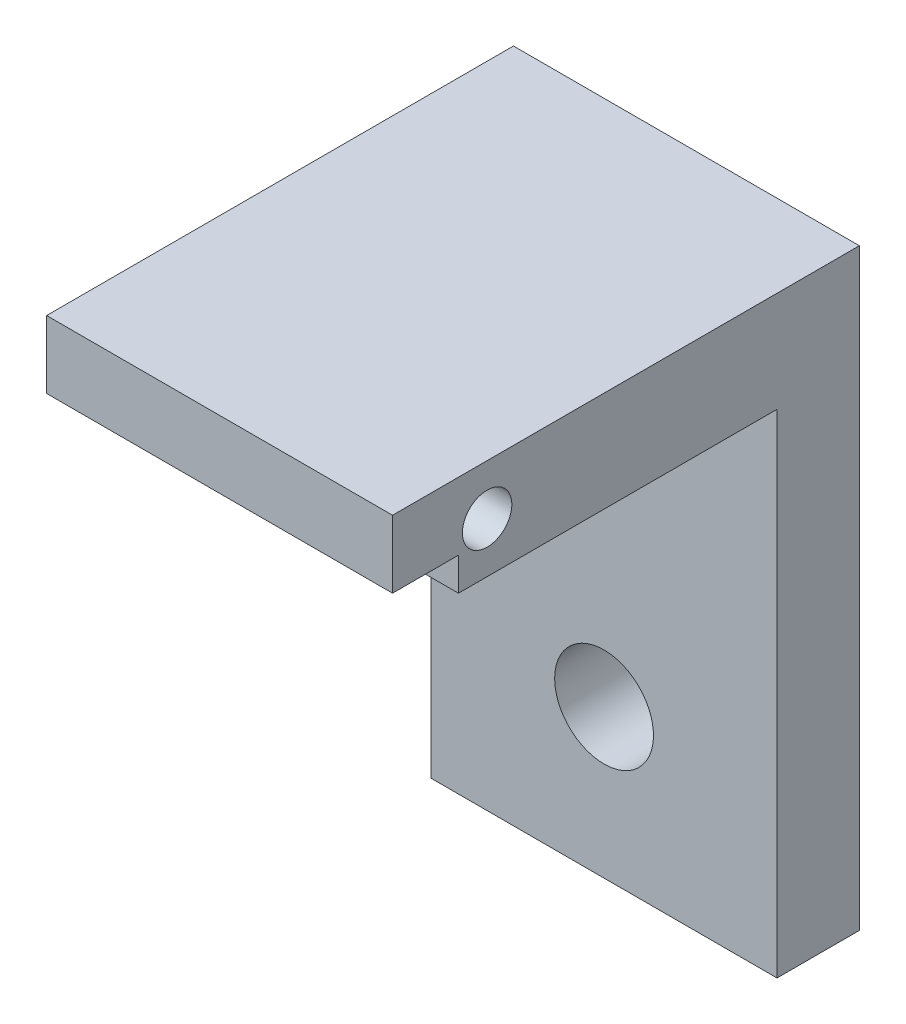
from build123d import *

# Parameters (mm, degrees)
SKETCH1_W           = 10.5
SKETCH1_H           = 5
BOSS_EXTRUDE1_DEPTH = 18
SKETCH2_W           = 10.5
SKETCH2_H           = 5
BOSS_EXTRUDE2_DEPTH = 7.3
SKETCH3_W           = 10.5
SKETCH3_H           = 1.95
CUT_EXTRUDE1_DEPTH  = 7.3
SKETCH4_W           = 10.5
SKETCH4_H           = 2.5
CUT_EXTRUDE2_DEPTH  = 26.3
SKETCH5_R           = 1.5
CUT_EXTRUDE3_DEPTH  = 26.3
SKETCH6_W           = 1.13
SKETCH6_H           = 3.05
CUT_EXTRUDE4_DEPTH  = 26.3
SKETCH10_W          = 10.5
SKETCH10_H          = 3.05
BOSS_EXTRUDE3_DEPTH = 5.5
SKETCH11_R          = 0.75
CUT_EXTRUDE6_DEPTH  = 12.5
SKETCH12_W          = 2
SKETCH12_H          = 1
CUT_EXTRUDE7_DEPTH  = 12.5


with BuildPart() as part:
    # Sketch1 → Boss-Extrude1 (new body)
    with BuildSketch(Plane(origin=(0, 0, 0), x_dir=(1, 0, 0), z_dir=(0, 1, 0))):
        Rectangle(SKETCH1_W, SKETCH1_H)
    extrude(amount=BOSS_EXTRUDE1_DEPTH)

    # Sketch2 → Boss-Extrude2 (add)
    with BuildSketch(Plane.XY.offset(2.5)):
        with Locations((0, 15.5)):
            Rectangle(SKETCH2_W, SKETCH2_H)
    extrude(amount=BOSS_EXTRUDE2_DEPTH)

    # Sketch3 → Cut-Extrude1 (cut)
    with BuildSketch(Plane.XY.offset(9.8)):
        with Locations((0, 13.975)):
            Rectangle(SKETCH3_W, SKETCH3_H)
    extrude(amount=-CUT_EXTRUDE1_DEPTH, mode=Mode.SUBTRACT)

    # Sketch4 → Cut-Extrude2 (cut)
    with BuildSketch(Plane(origin=(0, 0, 0), x_dir=(-1, 0, 0), z_dir=(0, -1, 0))):
        with Locations((0, 1.25)):
            Rectangle(SKETCH4_W, SKETCH4_H)
    extrude(amount=-CUT_EXTRUDE2_DEPTH, mode=Mode.SUBTRACT)

    # Sketch5 → Cut-Extrude3 (cut)
    with BuildSketch(Plane(origin=(0, 0, 0), x_dir=(-1, 0, 0), z_dir=(0, 0, -1))):
        with Locations((0, 4.5)):
            Circle(SKETCH5_R)
    extrude(amount=-CUT_EXTRUDE3_DEPTH, mode=Mode.SUBTRACT)

    # Sketch6 → Cut-Extrude4 (cut)
    with BuildSketch(Plane.ZY.offset(5.25)):
        with Locations((9.235, 16.475)):
            Rectangle(SKETCH6_W, SKETCH6_H)
    extrude(amount=-CUT_EXTRUDE4_DEPTH, mode=Mode.SUBTRACT)

    # Sketch10 → Boss-Extrude3 (add)
    with BuildSketch(Plane.XY.offset(8.67)):
        with Locations((0, 16.475)):
            Rectangle(SKETCH10_W, SKETCH10_H)
    extrude(amount=BOSS_EXTRUDE3_DEPTH)

    # Sketch11 → Cut-Extrude6 (cut)
    with BuildSketch(Plane.ZY.offset(5.25)):
        with Locations((11.3, 16.475)):
            Circle(SKETCH11_R)
    extrude(amount=-CUT_EXTRUDE6_DEPTH, mode=Mode.SUBTRACT)

    # Sketch12 → Cut-Extrude7 (cut)
    with BuildSketch(Plane.ZY.offset(5.25)):
        with Locations((13.17, 15.45)):
            Rectangle(SKETCH12_W, SKETCH12_H)
    extrude(amount=-CUT_EXTRUDE7_DEPTH, mode=Mode.SUBTRACT)


solid = part.part
